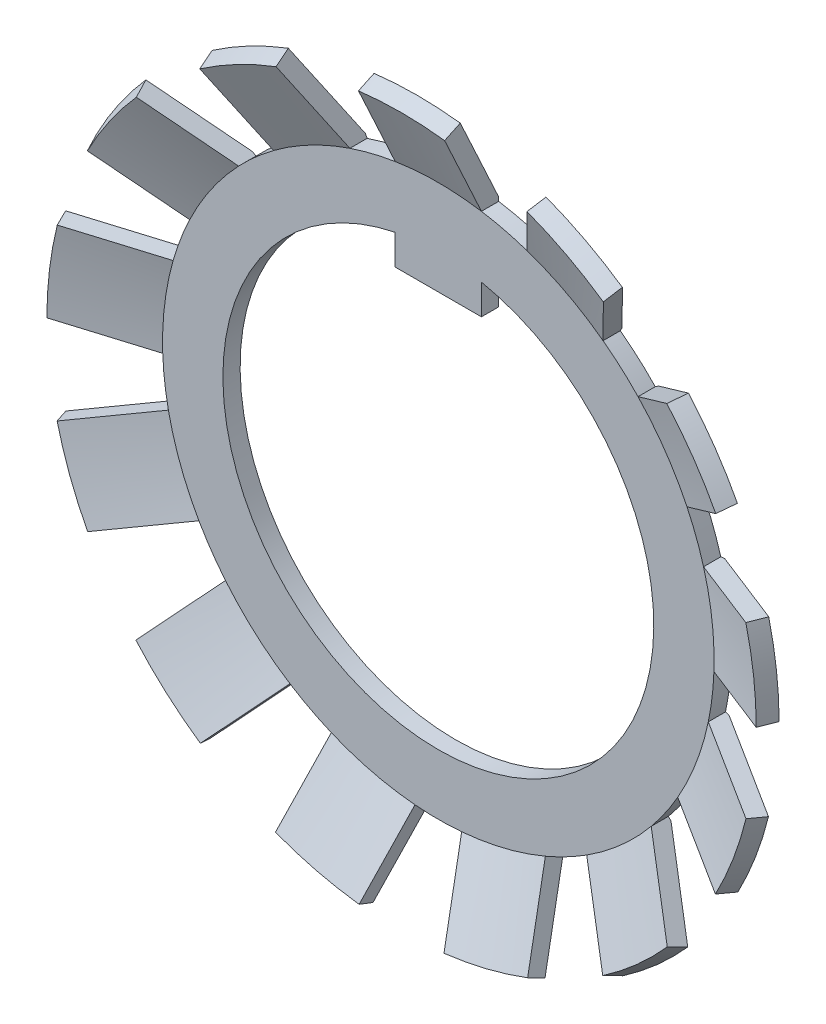
from build123d import *

# Parameters (mm, degrees)
CUT_EXTRUDE2_DEPTH  = 30.863437355
CIRPATTERN1_COUNT   = 13
BOSS_EXTRUDE1_START = -1
BOSS_EXTRUDE1_DEPTH = 1


with BuildPart() as part:
    # Sketch1 → Base-Revolve (revolve)
    with BuildSketch(Plane(origin=(0, 0, 0), x_dir=(0, 0, -1), z_dir=(1, 0, 0)), mode=Mode.PRIVATE) as base_revolve_sk:
        Polygon((0, 12.5), (0, 16.221694663), (-2.228160372, 21), (-3.134468159, 20.577381738), (-1, 16), (-1, 12.5), align=None)
    revolve(base_revolve_sk.sketch.rotate(Axis((0, 0, 14), (0, 0, -1)), 90), axis=Axis((0, 0, 14), (0, 0, -1)))

    # Sketch3 → Cut-Extrude2 (cut, through all)
    with BuildSketch(Plane(origin=(0, 0, 0), x_dir=(-1, 0, 0), z_dir=(0, 0, -1))):
        with BuildLine():
            Line((-2.5, 15.803480629), (-2.5, 20.850659462))
            ThreePointArc((-2.5, 20.850659462), (-5.02562895, 20.389778166), (-7.47614454, 19.62414999))
            Line((-7.47614454, 19.62414999), (-5.130603583, 15.15509508))
            ThreePointArc((-5.130603583, 15.15509508), (-3.829050629, 15.535069079), (-2.5, 15.803480629))
        make_face()
    cut_extrude2 = extrude(amount=-CUT_EXTRUDE2_DEPTH, mode=Mode.SUBTRACT)

    # CirPattern1: Cut-Extrude2 ×13 about axis
    cirpattern1_axis = Axis((0, 0, 0), (0, 0, 1))
    for i in range(1, CIRPATTERN1_COUNT):
        add(cut_extrude2.rotate(cirpattern1_axis, i * 360 / CIRPATTERN1_COUNT), mode=Mode.SUBTRACT)

    # Sketch4 → Boss-Extrude1 (add)
    with BuildSketch(Plane(origin=(0, 0, 0), x_dir=(-1, 0, 0), z_dir=(0, 0, -1)).offset(BOSS_EXTRUDE1_START)):
        with BuildLine():
            Line((-2.5, 12.247448714), (-2.5, 10.5))
            Line((-2.5, 10.5), (2.5, 10.5))
            Line((2.5, 10.5), (2.5, 12.247448714))
            ThreePointArc((2.5, 12.247448714), (0, 12.5), (-2.5, 12.247448714))
        make_face()
    extrude(amount=BOSS_EXTRUDE1_DEPTH)


solid = part.part
